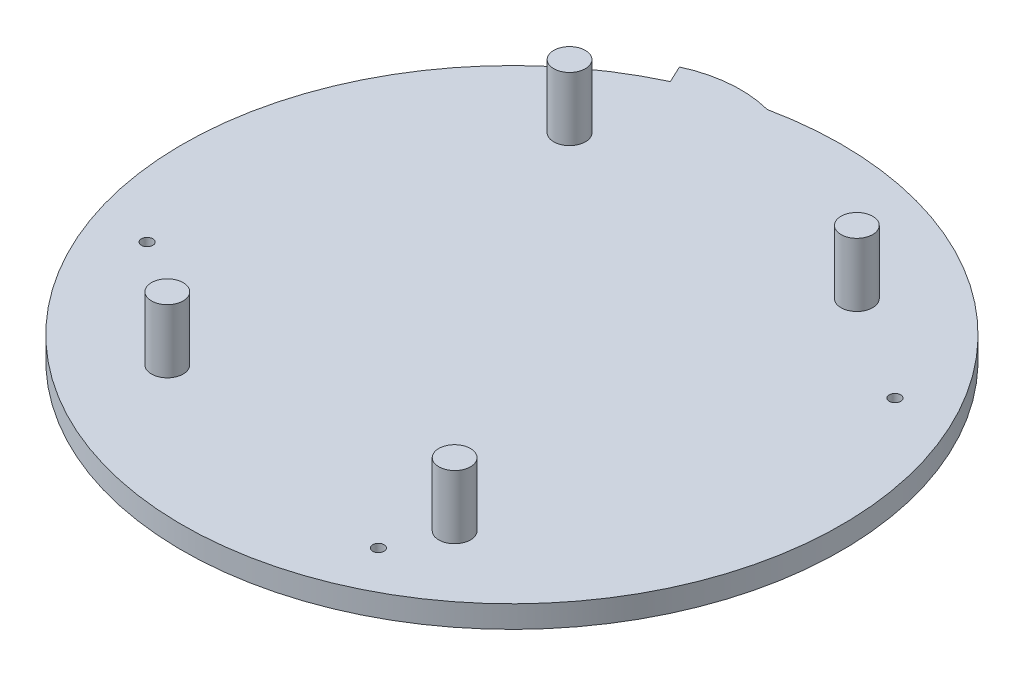
from build123d import *

# Parameters (mm, degrees)
BOSS_EXTRUDE1_DEPTH = 3.5
SKETCH2_R           = 0.9
CUT_EXTRUDE1_DEPTH  = 75.183799012
SKETCH3_R           = 2.5
BOSS_EXTRUDE2_DEPTH = 10
SKETCH4_R           = 0.9
CUT_EXTRUDE2_DEPTH  = 10


with BuildPart() as part:
    # Sketch1 → Boss-Extrude1 (new body)
    with BuildSketch(Plane(origin=(0, 0, 0), x_dir=(1, 0, 0), z_dir=(0, 1, 0))):
        with BuildLine():
            Line((-21.702078291, 46.665350003), (-22.976238483, 49.381324194))
            ThreePointArc((-22.976238483, 49.381324194), (-16.705296787, 51.039340816), (-10.242062523, 50.491315514))
            ThreePointArc((-10.242062523, 50.491315514), (16.850294685, -49.735366194), (-21.702078291, 46.665350003))
        make_face()
    extrude(amount=BOSS_EXTRUDE1_DEPTH)

    # Sketch2 → Cut-Extrude1 (cut, through all)
    with BuildSketch(Plane(origin=(0, 3.5, 0), x_dir=(1, 0, 0), z_dir=(0, 1, 0))):
        with Locations(Location((-41.040664553, -16.531295011, 0), (0, 0, 270))):
            Circle(SKETCH2_R)
        with Locations(Location((39.259074256, 21.140171457, 0), (0, 0, 270))):
            Circle(SKETCH2_R)
    extrude(amount=-CUT_EXTRUDE1_DEPTH, mode=Mode.SUBTRACT)

    # Sketch3 → Boss-Extrude2 (add)
    with BuildSketch(Plane(origin=(0, 3.5, 0), x_dir=(1, 0, 0), z_dir=(0, 1, 0))):
        with Locations(Location((-22.661676127, 31.726346577, 0), (0, 0, 270))):
            Circle(SKETCH3_R)
        with Locations(Location((22.661676127, 31.726346577, 0), (0, 0, 270))):
            Circle(SKETCH3_R)
        with Locations(Location((22.661676127, -31.726346577, 0), (0, 0, 90))):
            Circle(SKETCH3_R)
        with Locations(Location((-22.661676127, -31.726346577, 0), (0, 0, 90))):
            Circle(SKETCH3_R)
    extrude(amount=BOSS_EXTRUDE2_DEPTH)

    # Sketch4 → Cut-Extrude2 (cut)
    with BuildSketch(Plane.XZ):
        with Locations(Location((18.995826683, 40.085484141, 0), (0, 0, 270))):
            Circle(SKETCH4_R)
    extrude(amount=-CUT_EXTRUDE2_DEPTH, mode=Mode.SUBTRACT)


solid = part.part
